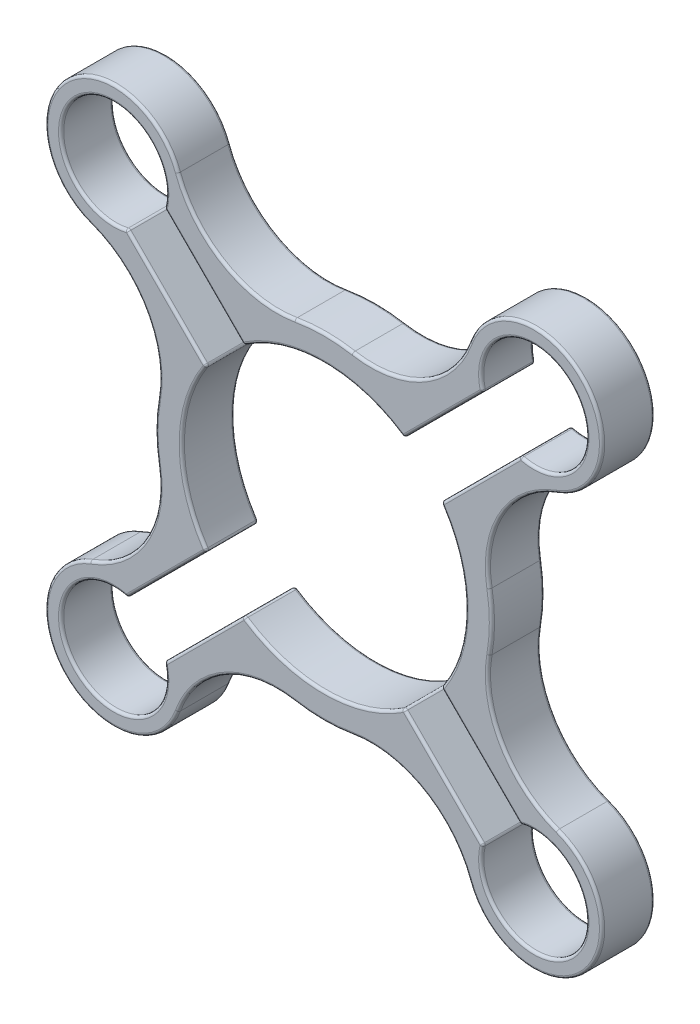
from build123d import *

# Parameters (mm, degrees)
BOSS_EXTRUDE1_DEPTH = 5
FILLET1_R           = 0.5


with BuildPart() as part:
    # Sketch1 → Boss-Extrude1 (new, symmetric)
    with BuildSketch(Plane.XY):
        with BuildLine():
            ThreePointArc((5.499886369, 31.523820357), (0, 32), (-5.499886369, 31.523820357))
            ThreePointArc((-5.499886369, 31.523820357), (-18.956279365, 33.916662735), (-27.733810979, 44.393071751))
            ThreePointArc((-27.733810979, 44.393071751), (-49.143921292, 49.143921292), (-44.393071751, 27.733810979))
            ThreePointArc((-44.393071751, 27.733810979), (-33.916662735, 18.956279365), (-31.523820357, 5.499886369))
            ThreePointArc((-31.523820357, 5.499886369), (-32, 0), (-31.523820357, -5.499886369))
            ThreePointArc((-31.523820357, -5.499886369), (-33.916662735, -18.956279365), (-44.393071751, -27.733810979))
            ThreePointArc((-44.393071751, -27.733810979), (-49.143921292, -49.143921292), (-27.733810979, -44.393071751))
            ThreePointArc((-27.733810979, -44.393071751), (-18.956279365, -33.916662735), (-5.499886369, -31.523820357))
            ThreePointArc((-5.499886369, -31.523820357), (0, -32), (5.499886369, -31.523820357))
            ThreePointArc((5.499886369, -31.523820357), (18.956279365, -33.916662735), (27.733810979, -44.393071751))
            ThreePointArc((27.733810979, -44.393071751), (49.143921292, -49.143921292), (44.393071751, -27.733810979))
            ThreePointArc((44.393071751, -27.733810979), (33.916662735, -18.956279365), (31.523820357, -5.499886369))
            ThreePointArc((31.523820357, -5.499886369), (32, 0), (31.523820357, 5.499886369))
            ThreePointArc((31.523820357, 5.499886369), (33.916662735, 18.956279365), (44.393071751, 27.733810979))
            ThreePointArc((44.393071751, 27.733810979), (49.143921292, 49.143921292), (27.733810979, 44.393071751))
            ThreePointArc((27.733810979, 44.393071751), (18.956279365, 33.916662735), (5.499886369, 31.523820357))
        make_face()
        with BuildLine():
            Line((15.226129133, 22.297196945), (30.292274874, 37.363342686))
            ThreePointArc((30.292274874, 37.363342686), (47.022600949, 47.022600949), (37.363342686, 30.292274874))
            Line((37.363342686, 30.292274874), (22.297196945, 15.226129133))
            ThreePointArc((22.297196945, 15.226129133), (27, 0), (22.297196945, -15.226129133))
            Line((22.297196945, -15.226129133), (37.363342686, -30.292274874))
            ThreePointArc((37.363342686, -30.292274874), (47.022600949, -47.022600949), (30.292274874, -37.363342686))
            Line((30.292274874, -37.363342686), (15.226129133, -22.297196945))
            ThreePointArc((15.226129133, -22.297196945), (0, -27), (-15.226129133, -22.297196945))
            Line((-15.226129133, -22.297196945), (-30.292274874, -37.363342686))
            ThreePointArc((-30.292274874, -37.363342686), (-47.022600949, -47.022600949), (-37.363342686, -30.292274874))
            Line((-37.363342686, -30.292274874), (-22.297196945, -15.226129133))
            ThreePointArc((-22.297196945, -15.226129133), (-27, 0), (-22.297196945, 15.226129133))
            Line((-22.297196945, 15.226129133), (-37.363342686, 30.292274874))
            ThreePointArc((-37.363342686, 30.292274874), (-47.022600949, 47.022600949), (-30.292274874, 37.363342686))
            Line((-30.292274874, 37.363342686), (-15.226129133, 22.297196945))
            ThreePointArc((-15.226129133, 22.297196945), (0, 27), (15.226129133, 22.297196945))
        make_face(mode=Mode.SUBTRACT)
    extrude(amount=BOSS_EXTRUDE1_DEPTH, both=True)

    # Fillet1
    fillet1_edges = [part.edges().sort_by_distance(p)[0] for p in [
        (18.956279365, 33.916662735, 5),
        (32, 0, -5),
        (33.916662735, -18.956279365, -5),
        (49.143921292, -49.143921292, -5),
        (0, 32, 5),
        (18.956279365, -33.916662735, -5),
        (0, -32, -5),
        (-18.956279365, -33.916662735, -5),
        (-49.143921292, -49.143921292, -5),
        (-33.916662735, -18.956279365, -5),
        (-32, 0, -5),
        (-33.916662735, 18.956279365, -5),
        (-49.143921292, 49.143921292, -5),
        (-18.956279365, 33.916662735, -5),
        (0, 32, -5),
        (-18.956279365, 33.916662735, 5),
        (18.956279365, 33.916662735, -5),
        (49.143921292, 49.143921292, -5),
        (33.916662735, 18.956279365, -5),
        (-49.143921292, 49.143921292, 5),
        (-33.916662735, 18.956279365, 5),
        (-32, 0, 5),
        (-33.916662735, -18.956279365, 5),
        (-49.143921292, -49.143921292, 5),
        (-18.956279365, -33.916662735, 5),
        (0, -32, 5),
        (33.916662735, 18.956279365, 5),
        (0, 27, -5),
        (15.226129133, 22.297196945, 0),
        (-22.759202004, 29.830269816, -5),
        (18.956279365, -33.916662735, 5),
        (-15.226129133, 22.297196945, 0),
        (-47.022600949, 47.022600949, -5),
        (-30.292274874, 37.363342686, 0),
        (-29.830269816, 22.759202004, -5),
        (-37.363342686, 30.292274874, 0),
        (-27, 0, -5),
        (-22.297196945, 15.226129133, 0),
        (-29.830269816, -22.759202004, -5),
        (-22.297196945, -15.226129133, 0),
        (-47.022600949, -47.022600949, -5),
        (-37.363342686, -30.292274874, 0),
        (-22.759202004, -29.830269816, -5),
        (-30.292274874, -37.363342686, 0),
        (0, -27, -5),
        (-15.226129133, -22.297196945, 0),
        (22.759202004, -29.830269816, -5),
        (15.226129133, -22.297196945, 0),
        (47.022600949, -47.022600949, -5),
        (30.292274874, -37.363342686, 0),
        (29.830269816, -22.759202004, -5),
        (49.143921292, -49.143921292, 5),
        (37.363342686, -30.292274874, 0),
        (27, 0, -5),
        (22.297196945, -15.226129133, 0),
        (29.830269816, 22.759202004, -5),
        (22.297196945, 15.226129133, 0),
        (47.022600949, 47.022600949, -5),
        (37.363342686, 30.292274874, 0),
        (22.759202004, 29.830269816, -5),
        (30.292274874, 37.363342686, 0),
        (0, 27, 5),
        (-22.759202004, 29.830269816, 5),
        (-47.022600949, 47.022600949, 5),
        (-29.830269816, 22.759202004, 5),
        (-27, 0, 5),
        (-29.830269816, -22.759202004, 5),
        (-47.022600949, -47.022600949, 5),
        (33.916662735, -18.956279365, 5),
        (-22.759202004, -29.830269816, 5),
        (0, -27, 5),
        (22.759202004, -29.830269816, 5),
        (47.022600949, -47.022600949, 5),
        (29.830269816, -22.759202004, 5),
        (27, 0, 5),
        (29.830269816, 22.759202004, 5),
        (47.022600949, 47.022600949, 5),
        (22.759202004, 29.830269816, 5),
        (32, 0, 5),
        (49.143921292, 49.143921292, 5),
    ]]
    fillet(fillet1_edges, radius=FILLET1_R)


solid = part.part
